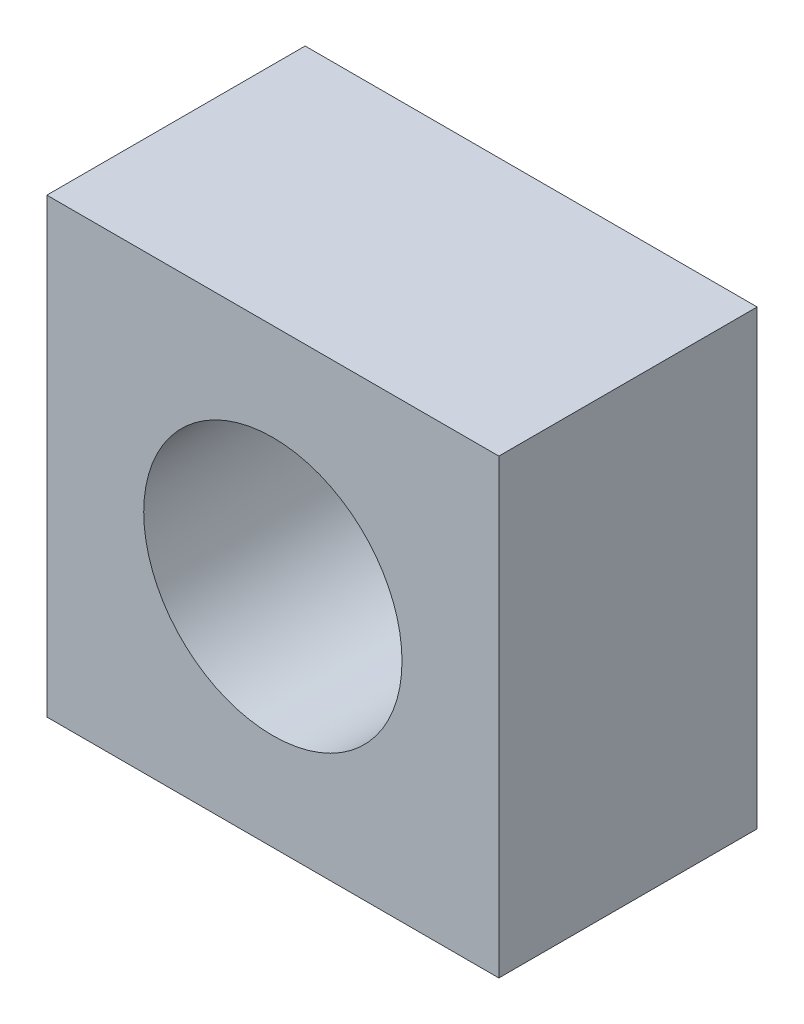
from build123d import *

# Parameters (mm, degrees)
SKETCH1_W           = 22.225
SKETCH1_H           = 22.225
SKETCH1_R           = 6.35
BOSS_EXTRUDE1_DEPTH = 12.7


with BuildPart() as part:
    # Sketch1 → Boss-Extrude1 (new body)
    with BuildSketch(Plane.XY):
        Rectangle(SKETCH1_W, SKETCH1_H)
        Circle(SKETCH1_R, mode=Mode.SUBTRACT)
    extrude(amount=BOSS_EXTRUDE1_DEPTH)


solid = part.part
